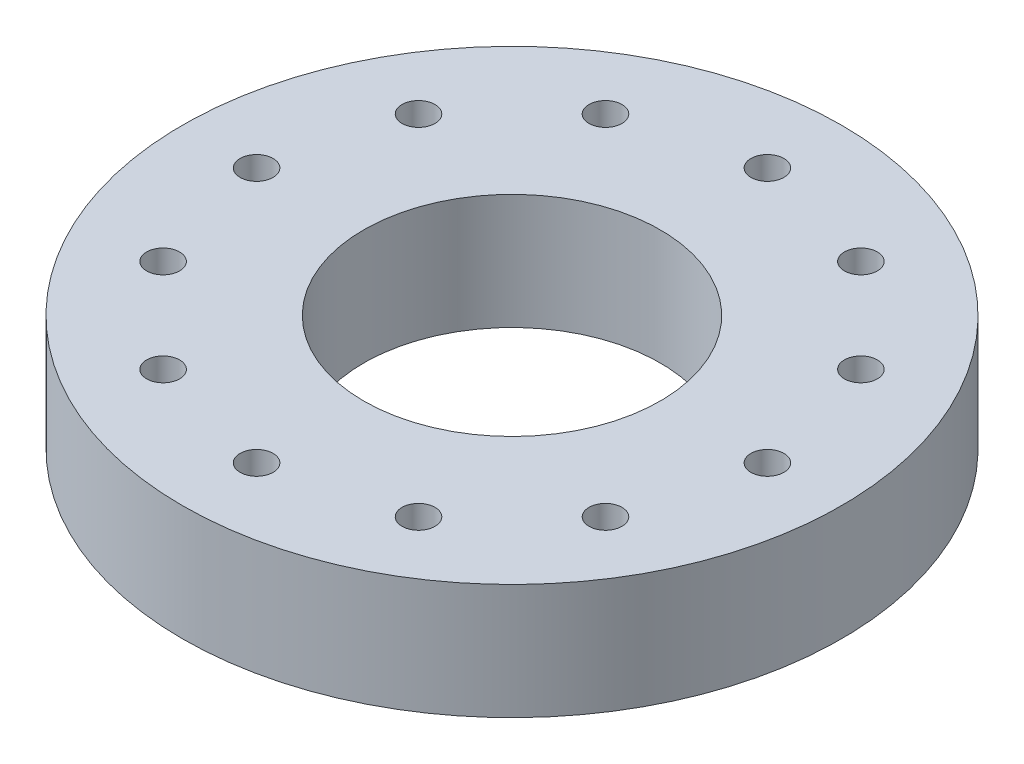
from build123d import *

# Parameters (mm, degrees)
SKETCH1_R           = 20
SKETCH1_R_2         = 9
SKETCH1_R_3         = 1
BOSS_EXTRUDE1_DEPTH = 7


with BuildPart() as part:
    # Sketch1 → Boss-Extrude1 (new body)
    with BuildSketch(Plane(origin=(0, 0, 0), x_dir=(1, 0, 0), z_dir=(0, 1, 0))):
        with Locations(Location((0, 0, 0), (0, 0, 270))):
            Circle(SKETCH1_R)
        with Locations(Location((0, 0, 0), (0, 0, 270))):
            Circle(SKETCH1_R_2, mode=Mode.SUBTRACT)
        with Locations(Location((0, 15.5, 0), (0, 0, 270))):
            Circle(SKETCH1_R_3, mode=Mode.SUBTRACT)
        with Locations(Location((7.75, 13.423393759, 0), (0, 0, 270))):
            Circle(SKETCH1_R_3, mode=Mode.SUBTRACT)
        with Locations(Location((13.423393759, 7.75, 0), (0, 0, 270))):
            Circle(SKETCH1_R_3, mode=Mode.SUBTRACT)
        with Locations(Location((15.5, 0, 0), (0, 0, 270))):
            Circle(SKETCH1_R_3, mode=Mode.SUBTRACT)
        with Locations(Location((13.423393759, -7.75, 0), (0, 0, 270))):
            Circle(SKETCH1_R_3, mode=Mode.SUBTRACT)
        with Locations(Location((7.75, -13.423393759, 0), (0, 0, 270))):
            Circle(SKETCH1_R_3, mode=Mode.SUBTRACT)
        with Locations(Location((0, -15.5, 0), (0, 0, 270))):
            Circle(SKETCH1_R_3, mode=Mode.SUBTRACT)
        with Locations(Location((-7.75, -13.423393759, 0), (0, 0, 270))):
            Circle(SKETCH1_R_3, mode=Mode.SUBTRACT)
        with Locations(Location((-13.423393759, -7.75, 0), (0, 0, 270))):
            Circle(SKETCH1_R_3, mode=Mode.SUBTRACT)
        with Locations(Location((-15.5, 0, 0), (0, 0, 270))):
            Circle(SKETCH1_R_3, mode=Mode.SUBTRACT)
        with Locations(Location((-13.423393759, 7.75, 0), (0, 0, 270))):
            Circle(SKETCH1_R_3, mode=Mode.SUBTRACT)
        with Locations(Location((-7.75, 13.423393759, 0), (0, 0, 270))):
            Circle(SKETCH1_R_3, mode=Mode.SUBTRACT)
    extrude(amount=BOSS_EXTRUDE1_DEPTH)


solid = part.part
